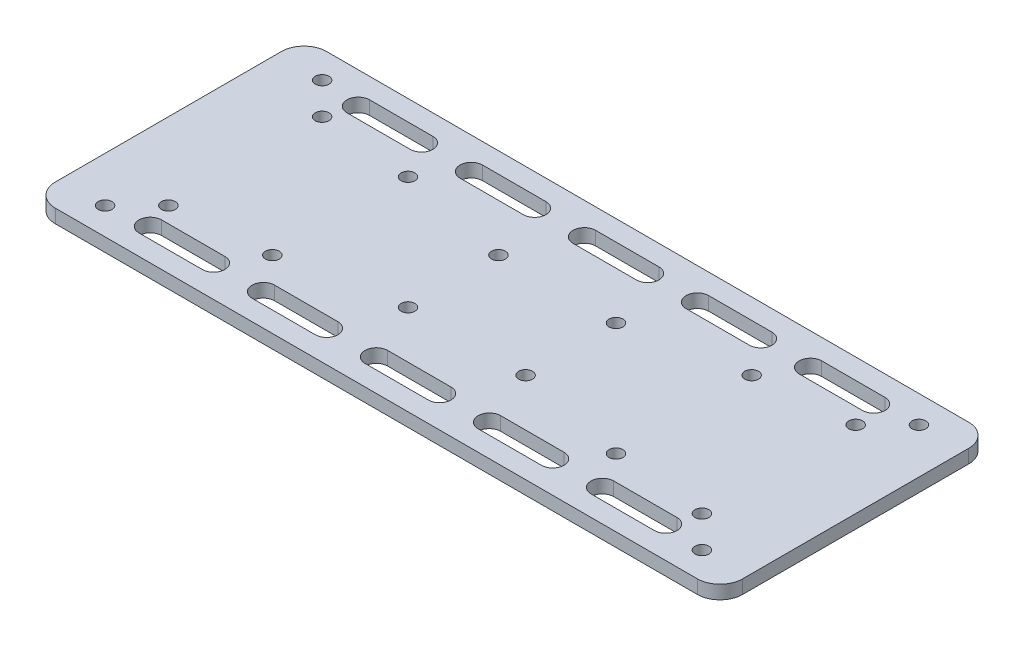
from build123d import *

# Parameters (mm, degrees)
SKETCH_1_W          = 152
SKETCH_1_H          = 60
EXTRUDE_1_DEPTH     = 3
CUT_EXTRUDE_1_REACH = 83.762
SKETCH_2_R          = 1.525
FILLET_1_R          = 5
CUT_EXTRUDE_2_REACH = 83.762
SKETCH_3_R          = 1.525
SKETCH_4_W          = 14
SKETCH_4_H          = 5
CUT_EXTRUDE_3_DEPTH = 3


with BuildPart() as part:
    # 草图1 → 凸台-拉伸1 (new body)
    with BuildSketch(Plane(origin=(0, 0, 0), x_dir=(1, 0, 0), z_dir=(0, 1, 0))):
        Rectangle(SKETCH_1_W, SKETCH_1_H)
    extrude(amount=EXTRUDE_1_DEPTH)

    # 草图2 → 切除-拉伸1 (cut, up to next)
    with BuildSketch(Plane(origin=(0, 3, 0), x_dir=(1, 0, 0), z_dir=(0, 1, 0)), mode=Mode.PRIVATE) as cut_extrude_1_sk1:
        with Locations(Location((-66, -24, 0), (0, 0, 270))):
            Circle(SKETCH_2_R)
    cut_extrude_1_tool1 = extrude(cut_extrude_1_sk1.sketch, amount=-CUT_EXTRUDE_1_REACH, mode=Mode.PRIVATE) & part.part
    # 草图2 → 切除-拉伸1 (cut, up to next)
    with BuildSketch(Plane(origin=(0, 3, 0), x_dir=(1, 0, 0), z_dir=(0, 1, 0)), mode=Mode.PRIVATE) as cut_extrude_1_sk2:
        with Locations(Location((-66, 24, 0), (0, 0, 270))):
            Circle(SKETCH_2_R)
    cut_extrude_1_tool2 = extrude(cut_extrude_1_sk2.sketch, amount=-CUT_EXTRUDE_1_REACH, mode=Mode.PRIVATE) & part.part
    # 草图2 → 切除-拉伸1 (cut, up to next)
    with BuildSketch(Plane(origin=(0, 3, 0), x_dir=(1, 0, 0), z_dir=(0, 1, 0)), mode=Mode.PRIVATE) as cut_extrude_1_sk3:
        with Locations(Location((66, -24, 0), (0, 0, 270))):
            Circle(SKETCH_2_R)
    cut_extrude_1_tool3 = extrude(cut_extrude_1_sk3.sketch, amount=-CUT_EXTRUDE_1_REACH, mode=Mode.PRIVATE) & part.part
    # 草图2 → 切除-拉伸1 (cut, up to next)
    with BuildSketch(Plane(origin=(0, 3, 0), x_dir=(1, 0, 0), z_dir=(0, 1, 0)), mode=Mode.PRIVATE) as cut_extrude_1_sk4:
        with Locations(Location((66, 24, 0), (0, 0, 270))):
            Circle(SKETCH_2_R)
    cut_extrude_1_tool4 = extrude(cut_extrude_1_sk4.sketch, amount=-CUT_EXTRUDE_1_REACH, mode=Mode.PRIVATE) & part.part
    add(cut_extrude_1_tool1.solids().sort_by_distance((-66, 3, 24))[0], mode=Mode.SUBTRACT)
    add(cut_extrude_1_tool2.solids().sort_by_distance((-66, 3, -24))[0], mode=Mode.SUBTRACT)
    add(cut_extrude_1_tool3.solids().sort_by_distance((66, 3, 24))[0], mode=Mode.SUBTRACT)
    add(cut_extrude_1_tool4.solids().sort_by_distance((66, 3, -24))[0], mode=Mode.SUBTRACT)

    # 圆角1
    fillet_1_edges = [part.edges().sort_by_distance(p)[0] for p in [
        (76, 1.5, 30),
        (-76, 1.5, 30),
        (-76, 1.5, -30),
        (76, 1.5, -30),
    ]]
    fillet(fillet_1_edges, radius=FILLET_1_R)

    # 草图3 → 切除-拉伸2 (cut, up to next)
    with BuildSketch(Plane(origin=(0, 3, 0), x_dir=(1, 0, 0), z_dir=(0, 1, 0)), mode=Mode.PRIVATE) as cut_extrude_2_sk1:
        with Locations(Location((-13, 10, 0), (0, 0, 270))):
            Circle(SKETCH_3_R)
    cut_extrude_2_tool1 = extrude(cut_extrude_2_sk1.sketch, amount=-CUT_EXTRUDE_2_REACH, mode=Mode.PRIVATE) & part.part
    # 草图3 → 切除-拉伸2 (cut, up to next)
    with BuildSketch(Plane(origin=(0, 3, 0), x_dir=(1, 0, 0), z_dir=(0, 1, 0)), mode=Mode.PRIVATE) as cut_extrude_2_sk2:
        with Locations(Location((-38, 15, 0), (0, 0, 270))):
            Circle(SKETCH_3_R)
    cut_extrude_2_tool2 = extrude(cut_extrude_2_sk2.sketch, amount=-CUT_EXTRUDE_2_REACH, mode=Mode.PRIVATE) & part.part
    # 草图3 → 切除-拉伸2 (cut, up to next)
    with BuildSketch(Plane(origin=(0, 3, 0), x_dir=(1, 0, 0), z_dir=(0, 1, 0)), mode=Mode.PRIVATE) as cut_extrude_2_sk3:
        with Locations(Location((-59, 17, 0), (0, 0, 270))):
            Circle(SKETCH_3_R)
    cut_extrude_2_tool3 = extrude(cut_extrude_2_sk3.sketch, amount=-CUT_EXTRUDE_2_REACH, mode=Mode.PRIVATE) & part.part
    # 草图3 → 切除-拉伸2 (cut, up to next)
    with BuildSketch(Plane(origin=(0, 3, 0), x_dir=(1, 0, 0), z_dir=(0, 1, 0)), mode=Mode.PRIVATE) as cut_extrude_2_sk4:
        with Locations(Location((-13, -10, 0), (0, 0, 270))):
            Circle(SKETCH_3_R)
    cut_extrude_2_tool4 = extrude(cut_extrude_2_sk4.sketch, amount=-CUT_EXTRUDE_2_REACH, mode=Mode.PRIVATE) & part.part
    # 草图3 → 切除-拉伸2 (cut, up to next)
    with BuildSketch(Plane(origin=(0, 3, 0), x_dir=(1, 0, 0), z_dir=(0, 1, 0)), mode=Mode.PRIVATE) as cut_extrude_2_sk5:
        with Locations(Location((-38, -15, 0), (0, 0, 270))):
            Circle(SKETCH_3_R)
    cut_extrude_2_tool5 = extrude(cut_extrude_2_sk5.sketch, amount=-CUT_EXTRUDE_2_REACH, mode=Mode.PRIVATE) & part.part
    # 草图3 → 切除-拉伸2 (cut, up to next)
    with BuildSketch(Plane(origin=(0, 3, 0), x_dir=(1, 0, 0), z_dir=(0, 1, 0)), mode=Mode.PRIVATE) as cut_extrude_2_sk6:
        with Locations(Location((-59, -17, 0), (0, 0, 270))):
            Circle(SKETCH_3_R)
    cut_extrude_2_tool6 = extrude(cut_extrude_2_sk6.sketch, amount=-CUT_EXTRUDE_2_REACH, mode=Mode.PRIVATE) & part.part
    # 草图3 → 切除-拉伸2 (cut, up to next)
    with BuildSketch(Plane(origin=(0, 3, 0), x_dir=(1, 0, 0), z_dir=(0, 1, 0)), mode=Mode.PRIVATE) as cut_extrude_2_sk7:
        with Locations(Location((13, -10, 0), (0, 0, 270))):
            Circle(SKETCH_3_R)
    cut_extrude_2_tool7 = extrude(cut_extrude_2_sk7.sketch, amount=-CUT_EXTRUDE_2_REACH, mode=Mode.PRIVATE) & part.part
    # 草图3 → 切除-拉伸2 (cut, up to next)
    with BuildSketch(Plane(origin=(0, 3, 0), x_dir=(1, 0, 0), z_dir=(0, 1, 0)), mode=Mode.PRIVATE) as cut_extrude_2_sk8:
        with Locations(Location((38, -15, 0), (0, 0, 270))):
            Circle(SKETCH_3_R)
    cut_extrude_2_tool8 = extrude(cut_extrude_2_sk8.sketch, amount=-CUT_EXTRUDE_2_REACH, mode=Mode.PRIVATE) & part.part
    # 草图3 → 切除-拉伸2 (cut, up to next)
    with BuildSketch(Plane(origin=(0, 3, 0), x_dir=(1, 0, 0), z_dir=(0, 1, 0)), mode=Mode.PRIVATE) as cut_extrude_2_sk9:
        with Locations(Location((59, -17, 0), (0, 0, 270))):
            Circle(SKETCH_3_R)
    cut_extrude_2_tool9 = extrude(cut_extrude_2_sk9.sketch, amount=-CUT_EXTRUDE_2_REACH, mode=Mode.PRIVATE) & part.part
    # 草图3 → 切除-拉伸2 (cut, up to next)
    with BuildSketch(Plane(origin=(0, 3, 0), x_dir=(1, 0, 0), z_dir=(0, 1, 0)), mode=Mode.PRIVATE) as cut_extrude_2_sk10:
        with Locations(Location((13, 10, 0), (0, 0, 270))):
            Circle(SKETCH_3_R)
    cut_extrude_2_tool10 = extrude(cut_extrude_2_sk10.sketch, amount=-CUT_EXTRUDE_2_REACH, mode=Mode.PRIVATE) & part.part
    # 草图3 → 切除-拉伸2 (cut, up to next)
    with BuildSketch(Plane(origin=(0, 3, 0), x_dir=(1, 0, 0), z_dir=(0, 1, 0)), mode=Mode.PRIVATE) as cut_extrude_2_sk11:
        with Locations(Location((38, 15, 0), (0, 0, 270))):
            Circle(SKETCH_3_R)
    cut_extrude_2_tool11 = extrude(cut_extrude_2_sk11.sketch, amount=-CUT_EXTRUDE_2_REACH, mode=Mode.PRIVATE) & part.part
    # 草图3 → 切除-拉伸2 (cut, up to next)
    with BuildSketch(Plane(origin=(0, 3, 0), x_dir=(1, 0, 0), z_dir=(0, 1, 0)), mode=Mode.PRIVATE) as cut_extrude_2_sk12:
        with Locations(Location((59, 17, 0), (0, 0, 270))):
            Circle(SKETCH_3_R)
    cut_extrude_2_tool12 = extrude(cut_extrude_2_sk12.sketch, amount=-CUT_EXTRUDE_2_REACH, mode=Mode.PRIVATE) & part.part
    add(cut_extrude_2_tool1.solids().sort_by_distance((-13, 3, -10))[0], mode=Mode.SUBTRACT)
    add(cut_extrude_2_tool2.solids().sort_by_distance((-38, 3, -15))[0], mode=Mode.SUBTRACT)
    add(cut_extrude_2_tool3.solids().sort_by_distance((-59, 3, -17))[0], mode=Mode.SUBTRACT)
    add(cut_extrude_2_tool4.solids().sort_by_distance((-13, 3, 10))[0], mode=Mode.SUBTRACT)
    add(cut_extrude_2_tool5.solids().sort_by_distance((-38, 3, 15))[0], mode=Mode.SUBTRACT)
    add(cut_extrude_2_tool6.solids().sort_by_distance((-59, 3, 17))[0], mode=Mode.SUBTRACT)
    add(cut_extrude_2_tool7.solids().sort_by_distance((13, 3, 10))[0], mode=Mode.SUBTRACT)
    add(cut_extrude_2_tool8.solids().sort_by_distance((38, 3, 15))[0], mode=Mode.SUBTRACT)
    add(cut_extrude_2_tool9.solids().sort_by_distance((59, 3, 17))[0], mode=Mode.SUBTRACT)
    add(cut_extrude_2_tool10.solids().sort_by_distance((13, 3, -10))[0], mode=Mode.SUBTRACT)
    add(cut_extrude_2_tool11.solids().sort_by_distance((38, 3, -15))[0], mode=Mode.SUBTRACT)
    add(cut_extrude_2_tool12.solids().sort_by_distance((59, 3, -17))[0], mode=Mode.SUBTRACT)

    # 草图4 → 切除-拉伸3 (cut)
    with BuildSketch(Plane(origin=(0, 3, 0), x_dir=(1, 0, 0), z_dir=(0, 1, 0))):
        with BuildLine():
            ThreePointArc((-57, -25.5), (-59.5, -23), (-57, -20.5))
            Line((-57, -20.5), (-57, -25.5))
        make_face()
        with Locations((-50, -23)):
            Rectangle(SKETCH_4_W, SKETCH_4_H)
        with BuildLine():
            ThreePointArc((-43, -20.5), (-40.5, -23), (-43, -25.5))
            Line((-43, -25.5), (-43, -20.5))
        make_face()
        with BuildLine():
            ThreePointArc((-32, -25.5), (-34.5, -23), (-32, -20.5))
            Line((-32, -20.5), (-32, -25.5))
        make_face()
        with Locations((-25, -23)):
            Rectangle(SKETCH_4_W, SKETCH_4_H)
        with BuildLine():
            ThreePointArc((-18, -20.5), (-15.5, -23), (-18, -25.5))
            Line((-18, -25.5), (-18, -20.5))
        make_face()
        with BuildLine():
            ThreePointArc((-7, -25.5), (-9.5, -23), (-7, -20.5))
            Line((-7, -20.5), (-7, -25.5))
        make_face()
        with Locations((0, -23)):
            Rectangle(SKETCH_4_W, SKETCH_4_H)
        with BuildLine():
            ThreePointArc((7, -20.5), (9.5, -23), (7, -25.5))
            Line((7, -25.5), (7, -20.5))
        make_face()
        with BuildLine():
            Line((18, -20.5), (18, -25.5))
            ThreePointArc((18, -25.5), (15.5, -23), (18, -20.5))
        make_face()
        with Locations((25, -23)):
            Rectangle(SKETCH_4_W, SKETCH_4_H)
        with BuildLine():
            Line((32, -20.5), (32, -25.5))
            ThreePointArc((32, -25.5), (34.5, -23), (32, -20.5))
        make_face()
        with BuildLine():
            Line((43, -20.5), (43, -25.5))
            ThreePointArc((43, -25.5), (40.5, -23), (43, -20.5))
        make_face()
        with Locations((50, -23)):
            Rectangle(SKETCH_4_W, SKETCH_4_H)
        with BuildLine():
            Line((57, -20.5), (57, -25.5))
            ThreePointArc((57, -25.5), (59.5, -23), (57, -20.5))
        make_face()
        with BuildLine():
            Line((-57, 20.5), (-57, 25.5))
            ThreePointArc((-57, 25.5), (-59.5, 23), (-57, 20.5))
        make_face()
        with Locations((-50, 23)):
            Rectangle(SKETCH_4_W, SKETCH_4_H)
        with BuildLine():
            Line((-43, 20.5), (-43, 25.5))
            ThreePointArc((-43, 25.5), (-40.5, 23), (-43, 20.5))
        make_face()
        with BuildLine():
            Line((-32, 20.5), (-32, 25.5))
            ThreePointArc((-32, 25.5), (-34.5, 23), (-32, 20.5))
        make_face()
        with Locations((-25, 23)):
            Rectangle(SKETCH_4_W, SKETCH_4_H)
        with BuildLine():
            Line((-18, 20.5), (-18, 25.5))
            ThreePointArc((-18, 25.5), (-15.5, 23), (-18, 20.5))
        make_face()
        with BuildLine():
            Line((-7, 20.5), (-7, 25.5))
            ThreePointArc((-7, 25.5), (-9.5, 23), (-7, 20.5))
        make_face()
        with Locations((0, 23)):
            Rectangle(SKETCH_4_W, SKETCH_4_H)
        with BuildLine():
            Line((7, 20.5), (7, 25.5))
            ThreePointArc((7, 25.5), (9.5, 23), (7, 20.5))
        make_face()
        with BuildLine():
            ThreePointArc((18, 20.5), (15.5, 23), (18, 25.5))
            Line((18, 25.5), (18, 20.5))
        make_face()
        with Locations((25, 23)):
            Rectangle(SKETCH_4_W, SKETCH_4_H)
        with BuildLine():
            ThreePointArc((32, 25.5), (34.5, 23), (32, 20.5))
            Line((32, 20.5), (32, 25.5))
        make_face()
        with BuildLine():
            ThreePointArc((43, 20.5), (40.5, 23), (43, 25.5))
            Line((43, 25.5), (43, 20.5))
        make_face()
        with Locations((50, 23)):
            Rectangle(SKETCH_4_W, SKETCH_4_H)
        with BuildLine():
            ThreePointArc((57, 25.5), (59.5, 23), (57, 20.5))
            Line((57, 20.5), (57, 25.5))
        make_face()
    extrude(amount=-CUT_EXTRUDE_3_DEPTH, mode=Mode.SUBTRACT)


solid = part.part
